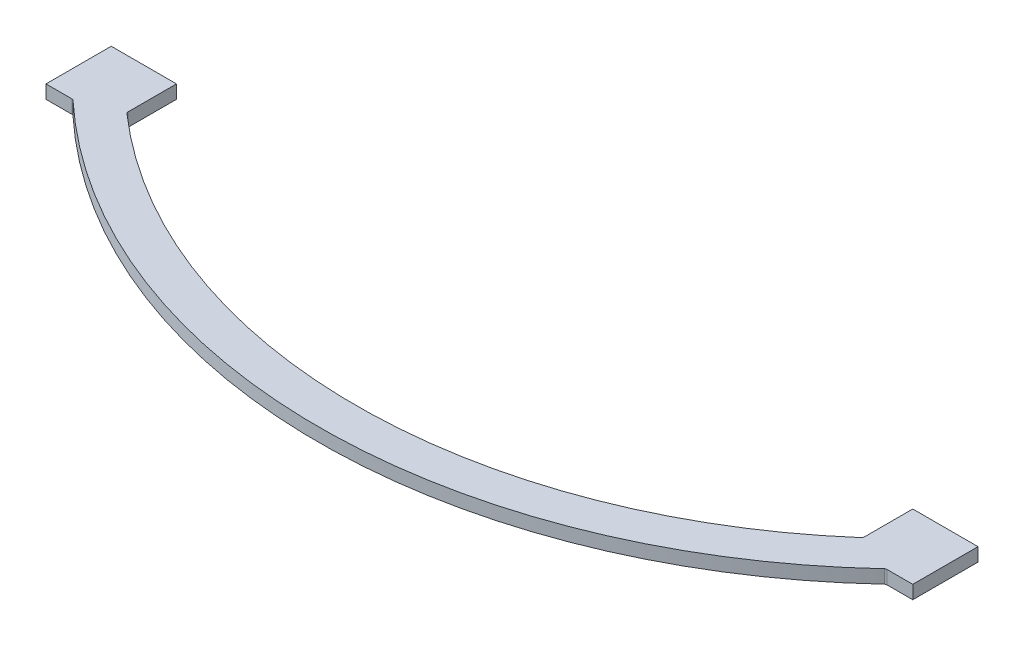
from build123d import *

# Parameters (mm, degrees)
BOSS_EXTRUDE1_DEPTH = 18.25625
SKETCH4_W           = 88.9
SKETCH4_H           = 88.9
BOSS_EXTRUDE2_DEPTH = 18.25625
FILLET1_R           = 3.3782


with BuildPart() as part:
    # Sketch3 → Boss-Extrude1 (new body)
    with BuildSketch(Plane(origin=(0, 0, 0), x_dir=(1, 0, 0), z_dir=(0, 1, 0))):
        with BuildLine():
            Line((-501.65, -501.65), (-590.55, -590.55))
            Line((-590.55, -590.55), (-553.84414606, -590.55))
            ThreePointArc((-553.84414606, -590.55), (0, -809.625), (553.84414606, -590.55))
            Line((553.84414606, -590.55), (590.55, -590.55))
            Line((590.55, -590.55), (501.65, -501.65))
            Line((501.65, -501.65), (501.65, -569.352841501))
            ThreePointArc((501.65, -569.352841501), (0, -758.825), (-501.65, -569.352841501))
            Line((-501.65, -569.352841501), (-501.65, -501.65))
        make_face()
    extrude(amount=BOSS_EXTRUDE1_DEPTH)

    # Sketch4 → Boss-Extrude2 (add)
    with BuildSketch(Plane(origin=(0, 18.25625, 0), x_dir=(1, 0, 0), z_dir=(0, 1, 0))):
        with Locations((-546.1, -546.1)):
            Rectangle(SKETCH4_W, SKETCH4_H)
        with Locations((546.1, -546.1)):
            Rectangle(SKETCH4_W, SKETCH4_H)
    extrude(amount=-BOSS_EXTRUDE2_DEPTH)

    # Fillet1
    fillet1_edges = [part.edges().sort_by_distance(p)[0] for p in [
        (-501.65, 9.128125, 569.352841501),
        (501.65, 9.128125, 569.352841501),
        (553.84414606, 9.128125, 590.55),
        (-553.84414606, 9.128125, 590.55),
    ]]
    fillet(fillet1_edges, radius=FILLET1_R)


solid = part.part
